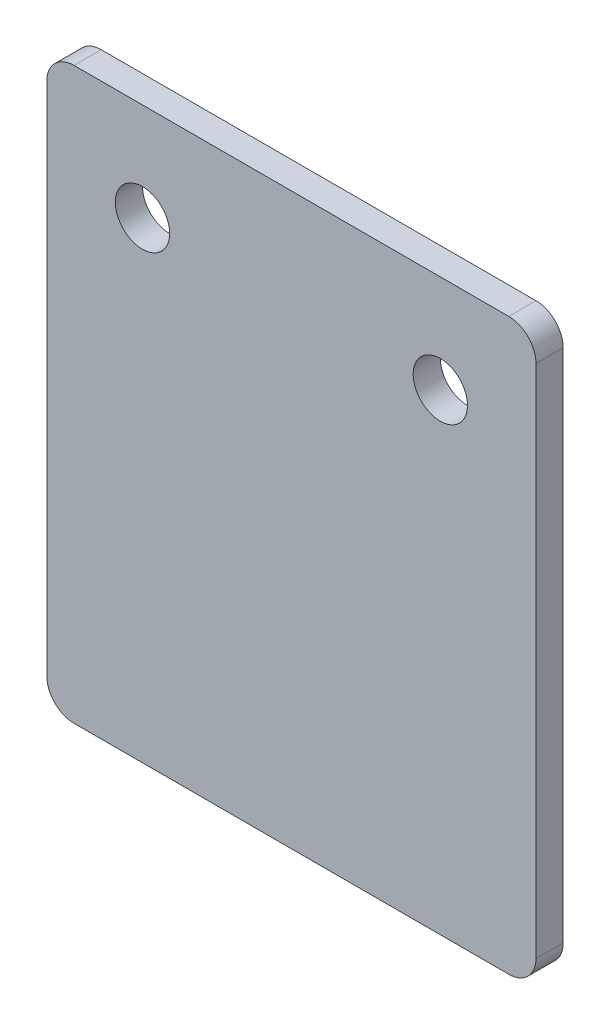
from build123d import *

# Parameters (mm, degrees)
BOSS_EXTRUDE1_DEPTH = 3.175
SKETCH2_R           = 3.175
CUT_EXTRUDE1_DEPTH  = 67.929307933


with BuildPart() as part:
    # Sketch1 → Boss-Extrude1 (new body)
    with BuildSketch(Plane.XY):
        with BuildLine():
            Line((-28.328951223, 3.070773738), (-28.328951223, -34.922456704))
            Line((-28.328951223, -34.922456704), (-28.328951223, -57.147456704))
            ThreePointArc((-28.328951223, -57.147456704), (-27.399015253, -59.392520734), (-25.153951223, -60.322456704))
            Line((-25.153951223, -60.322456704), (25.646048777, -60.322456704))
            ThreePointArc((25.646048777, -60.322456704), (27.891112807, -59.392520734), (28.821048777, -57.147456704))
            Line((28.821048777, -57.147456704), (28.821048777, -34.922456704))
            Line((28.821048777, -34.922456704), (28.821048777, 3.070773738))
            ThreePointArc((28.821048777, 3.070773738), (27.891112807, 5.315837768), (25.646048777, 6.245773738))
            Line((25.646048777, 6.245773738), (-25.153951223, 6.245773738))
            ThreePointArc((-25.153951223, 6.245773738), (-27.399015253, 5.315837768), (-28.328951223, 3.070773738))
        make_face()
    extrude(amount=-BOSS_EXTRUDE1_DEPTH)

    # Sketch2 → Cut-Extrude1 (cut, through all)
    with BuildSketch(Plane.XY):
        with Locations((-17.152951223, -5.184226262)):
            Circle(SKETCH2_R)
        with Locations(Location((17.645048777, -5.184226262, 0), (0, 0, 180))):
            Circle(SKETCH2_R)
    extrude(amount=-CUT_EXTRUDE1_DEPTH, mode=Mode.SUBTRACT)


solid = part.part
